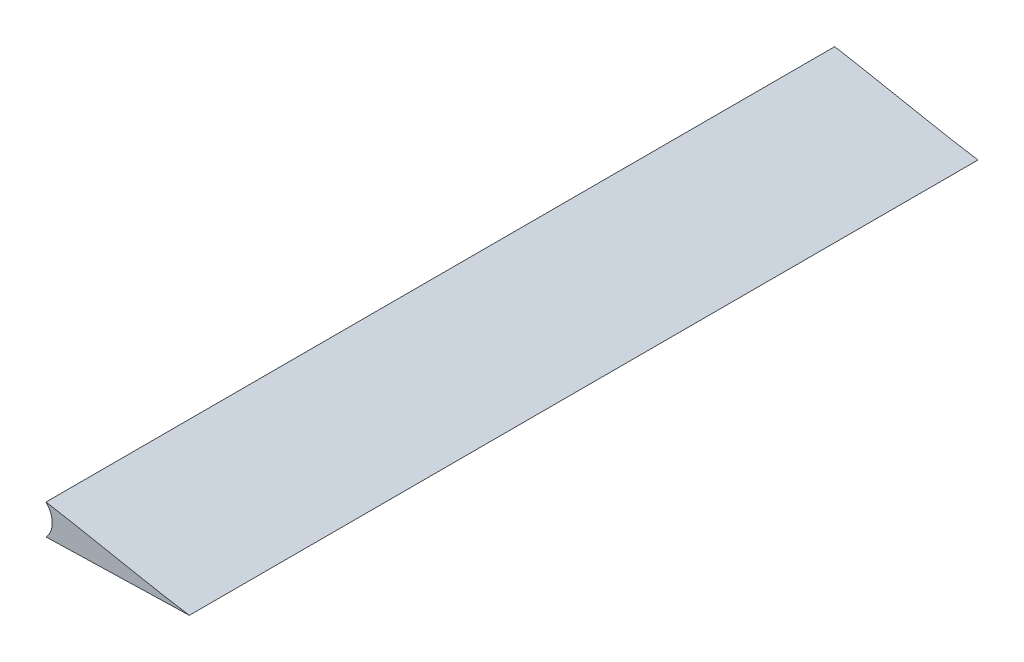
from build123d import *

# Parameters (mm, degrees)
BOSS_EXTRUDE1_DEPTH     = 875
CUT_EXTRUDE1_DEPTH      = 881.879454843
CUT_EXTRUDE1_DEPTH_BACK = 881.879454843
CUT_EXTRUDE2_DEPTH      = 328.226273651


with BuildPart() as part:
    # Sketch1 → Boss-Extrude1 (new, symmetric)
    with BuildSketch(Plane.XY):
        with BuildLine():
            add(Edge.make_bspline(
                [(100.91824287, -5.70312156), (100.917928302, -5.691984058), (100.103872555, -5.623522289), (99.280592479, -5.464574379), (97.301838761, -5.167293181), (94.893792204, -4.740313208), (91.763418033, -4.194020721), (88.075779131, -3.527092424), (83.82586832, -2.733839889), (79.07466539, -1.829159833), (73.868292655, -0.815261424), (68.257586758, 0.28149671), (62.297699244, 1.44772436), (56.040627516, 2.659541325), (49.522304418, 3.863298421), (42.776163339, 5.024182063), (35.842465214, 6.159362695), (28.754894986, 7.225237491), (21.557088168, 8.212036363), (14.289938921, 9.11702244), (6.986491581, 9.896502104), (-0.312291465, 10.567439736), (-7.573250933, 11.101452566), (-14.756788427, 11.484472196), (-21.829214216, 11.73432499), (-28.756354515, 11.821009192), (-35.503522333, 11.750617393), (-42.039927215, 11.528099679), (-48.337618053, 11.139668586), (-54.368823591, 10.599316119), (-60.107813763, 9.916065983), (-65.5246312, 9.082841334), (-70.600710971, 8.133580398), (-75.312124387, 7.06030936), (-79.639012678, 5.882400605), (-83.565794194, 4.620592947), (-87.074573399, 3.286478994), (-90.155255222, 1.908430123), (-92.7947781, 0.504611279), (-94.983077923, -0.904381491), (-96.712918902, -2.27019758), (-98.000485425, -3.580792759), (-98.761905736, -4.743195836), (-99.230109063, -5.858193724), (-98.606025292, -6.870082158), (-97.444377041, -7.545330585), (-95.746709082, -8.188615648), (-93.444858666, -8.65302005), (-90.532849186, -8.981809806), (-87.012786058, -9.249938029), (-82.906631066, -9.471230862), (-78.240220774, -9.591108348), (-73.047587861, -9.700035936), (-67.364458994, -9.726825212), (-61.232945666, -9.735598818), (-54.695580066, -9.663971329), (-47.787860167, -9.57405054), (-40.547660449, -9.399905225), (-33.014906842, -9.224168897), (-25.241541211, -9.024405524), (-17.28179212, -8.801970667), (-9.194124895, -8.575484575), (-1.034753503, -8.389600976), (7.134931724, -8.163914261), (15.261915306, -7.937211966), (23.292019947, -7.753265877), (31.171989128, -7.520412865), (38.853338861, -7.320323338), (46.282726984, -7.155039977), (53.396722649, -6.942825345), (60.134764376, -6.764425726), (66.461797873, -6.610760114), (72.370019545, -6.444067915), (77.851690837, -6.304693879), (82.870292529, -6.189451934), (87.37297449, -6.074184551), (91.286636897, -5.943657403), (94.610580102, -5.86381881), (97.158504539, -5.820700532), (99.231452991, -5.738256396), (100.085997803, -5.733999914), (100.918560502, -5.714367546), (100.91824287, -5.70312156)],
                knots=[0, 0, 0, 0, 0.000950607, 0.003756507, 0.008317118, 0.014521534, 0.022293258, 0.031559824, 0.042220752, 0.054150955, 0.067231026, 0.081331038, 0.096307423, 0.112011952, 0.128327294, 0.145184499, 0.162487629, 0.180135525, 0.198033488, 0.216058829, 0.234134495, 0.252191782, 0.270104077, 0.287817033, 0.305234681, 0.322284448, 0.338896329, 0.354986109, 0.370505848, 0.385416956, 0.399632136, 0.413115968, 0.42582253, 0.437703697, 0.448737409, 0.458879724, 0.468105333, 0.476404612, 0.483748471, 0.49013386, 0.495557186, 0.500011534, 0.503516098, 0.506001286, 0.508215361, 0.511493607, 0.515843652, 0.521547383, 0.528754592, 0.537448665, 0.547575188, 0.55907379, 0.571867409, 0.585873248, 0.600979911, 0.617080267, 0.634081341, 0.651920682, 0.670483603, 0.689642387, 0.709259499, 0.729200941, 0.749303287, 0.769441295, 0.789466278, 0.8092541, 0.828669736, 0.847597548, 0.865914743, 0.883466594, 0.900078509, 0.915617835, 0.930134998, 0.943663107, 0.956049855, 0.967158865, 0.976852657, 0.984995817, 0.991471781, 0.996183553, 0.999040133, 1, 1, 1, 1], degree=3))
        make_face()
    extrude(amount=BOSS_EXTRUDE1_DEPTH, both=True)

    # Sketch3 → Cut-Extrude1 (cut, two sides: drawn at the far end of the back side and taken through both)
    with BuildSketch(Plane(origin=(0, 0, 0), x_dir=(1, 0, 0), z_dir=(0, 1, 0)).offset(-CUT_EXTRUDE1_DEPTH_BACK)):
        Polygon((100.918243231, 835.9), (44.370126982, 835.9), (44.370126982, 524.707472239), (100.918243231, 524.707472239), (100.918243231, -524.707472239), (44.370126982, -524.707472239), (44.370126982, -835.9), (100.918243231, -835.9), (100.918243231, -1428.407127824), (-134.13320566, -1428.407127824), (-134.13320566, 941.271454546), (100.918243231, 941.271454546), align=None)
    extrude(amount=CUT_EXTRUDE1_DEPTH + CUT_EXTRUDE1_DEPTH_BACK, mode=Mode.SUBTRACT)


with BuildPart() as cut_extrude1_piece_1:
    # of the separate pieces the step leaves, piece 1, a body of its own (cut_extrude1_pieces)
    add(part.part.solids().sort_by_distance((100.91824311, -5.703138592, 524.707472239))[0])

    # Sketch4 → Cut-Extrude2 (cut, through all)
    with BuildSketch(Plane.XY.offset(835.9)):
        with BuildLine():
            Line((44.370126982, 4.745424617), (44.370126982, -7.193951111))
            ThreePointArc((44.370126982, -7.193951111), (46.842852659, -1.224263247), (44.370126982, 4.745424617))
        make_face()
    extrude(amount=-CUT_EXTRUDE2_DEPTH, mode=Mode.SUBTRACT)


with BuildPart() as cut_extrude1_piece_2:
    # of the separate pieces the step leaves, piece 2, a body of its own (cut_extrude1_pieces)
    add(part.part.solids().sort_by_distance((44.370126982, 4.745424617, -524.707472239))[0])


solid = cut_extrude1_piece_1.part
